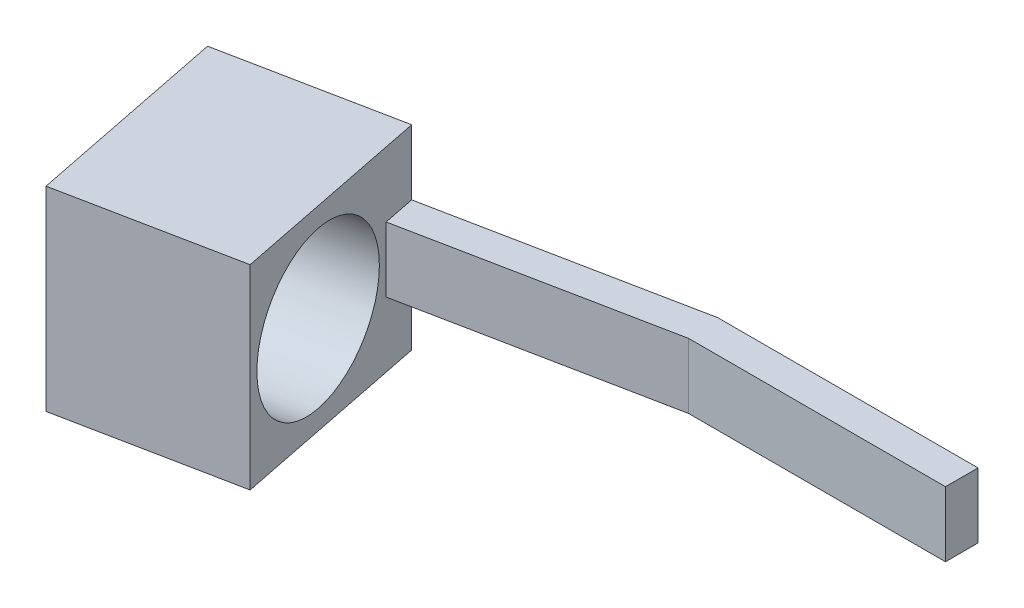
from build123d import *

# Parameters (mm, degrees)
SKETCH1_W                        = 12
SKETCH1_H                        = 1.5
BOSS_EXTRUDE1_DEPTH              = 3
BOSS_EXTRUDE2_DEPTH              = 3
BOSS_EXTRUDE3_DEPTH              = 3
BOSS_EXTRUDE3_DEPTH_BACK         = 6
F_97_0_0059_DIAMETER_HOLE1_D     = 7.200000078
F_97_0_0059_DIAMETER_HOLE1_DEPTH = 10


with BuildPart() as part:
    # Sketch1 → Boss-Extrude1 (new body)
    with BuildSketch(Plane(origin=(0, 0, 0), x_dir=(1, 0, 0), z_dir=(0, 1, 0))):
        with Locations((6, 0.75)):
            Rectangle(SKETCH1_W, SKETCH1_H)
    extrude(amount=BOSS_EXTRUDE1_DEPTH)

    # Sketch2 → Boss-Extrude2 (add)
    with BuildSketch(Plane(origin=(0, 3, 0), x_dir=(1, 0, 0), z_dir=(0, 1, 0))):
        Polygon((0, 1.5), (-11.766968108, -0.853393621), (-11.472793906, -2.324264634), (0.294174203, 0.029128986), align=None)
    extrude(amount=-BOSS_EXTRUDE2_DEPTH)

    # Sketch4 → Boss-Extrude3 (add, two sides: drawn at the far end of the back side and taken through both)
    with BuildSketch(Plane(origin=(0, 3, 0), x_dir=(1, 0, 0), z_dir=(0, 1, 0)).offset(-BOSS_EXTRUDE3_DEPTH_BACK)):
        Polygon((-11.766968108, -0.853393621), (-9.903864825, -10.16891004), (-17.748510231, -11.737839121), (-19.611613514, -2.422322701), align=None)
    extrude(amount=BOSS_EXTRUDE3_DEPTH + BOSS_EXTRUDE3_DEPTH_BACK)

    # #97 (0.0059) Diameter Hole1
    with Locations(Plane(origin=(-19.323151976, 0, 3.864630394), x_dir=(0.19611613506937434, 0, 0.9805806757046821), z_dir=(-0.9805806757046821, 0, 0.19611613506937434))):
        with Locations((4.029128986, 1.5)):
            Hole(F_97_0_0059_DIAMETER_HOLE1_D / 2, depth=F_97_0_0059_DIAMETER_HOLE1_DEPTH)


solid = part.part
